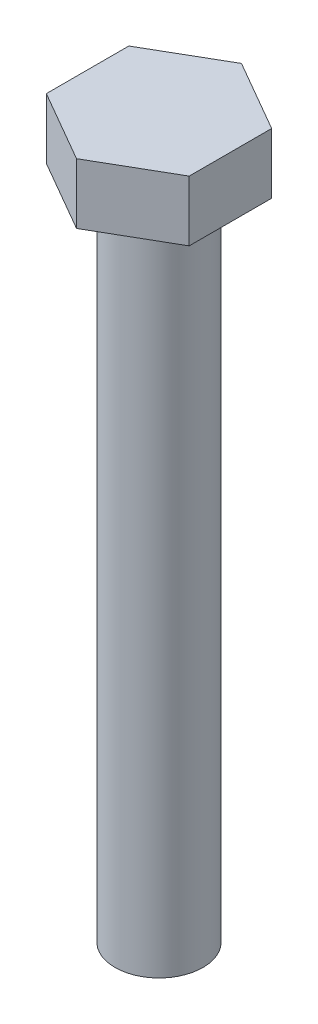
from build123d import *

# Parameters (mm, degrees)
BOSS_EXTRU_1_DEPTH = 5.5
ESQUISSE2_R        = 4
BOSS_EXTRU_2_DEPTH = 60


with BuildPart() as part:
    # Esquisse1 → Boss.-Extru.1 (new body)
    with BuildSketch(Plane(origin=(0, 0, 0), x_dir=(1, 0, 0), z_dir=(0, 1, 0))):
        Polygon((6.5, 3.75277675), (0, 7.505553499), (-6.5, 3.75277675), (-6.5, -3.75277675), (0, -7.505553499), (6.5, -3.75277675), align=None)
    extrude(amount=BOSS_EXTRU_1_DEPTH)

    # Esquisse2 → Boss.-Extru.2 (add)
    with BuildSketch(Plane(origin=(0, 0, 0), x_dir=(1, 0, 0), z_dir=(0, 1, 0))):
        with Locations(Location((0, 0, 0), (0, 0, 270))):
            Circle(ESQUISSE2_R)
    extrude(amount=-BOSS_EXTRU_2_DEPTH)


solid = part.part
